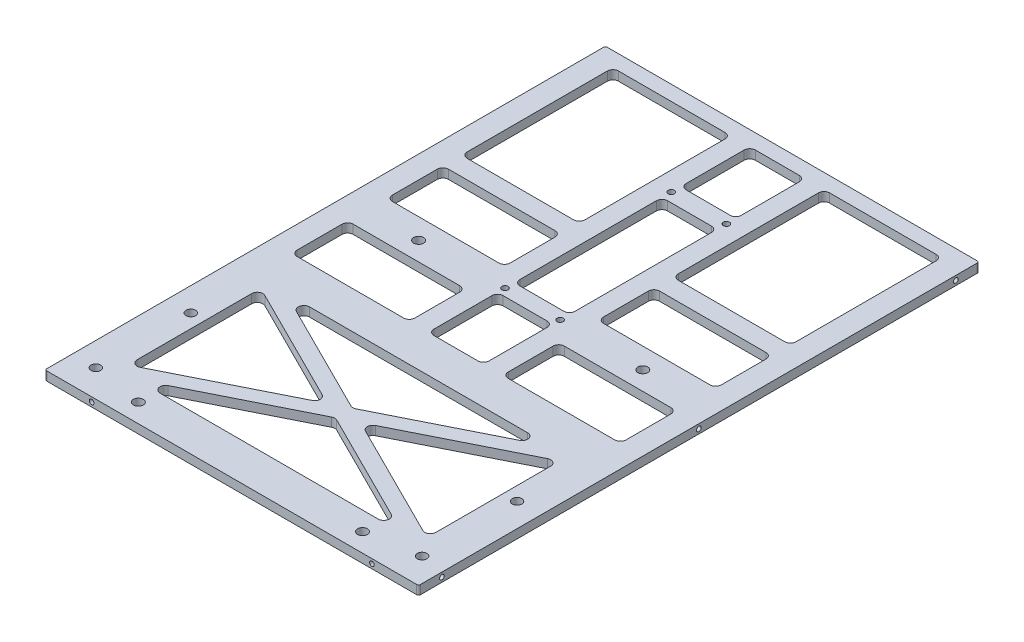
from build123d import *

# Parameters (mm, degrees)
SKETCH1_W                            = 200
SKETCH1_H                            = 300
BOSS_EXTRUDE1_DEPTH                  = 4.7625
F_1_4_20_TAPPED_HOLE1_D              = 5.1054
M4X0_7_TAPPED_HOLE1_D                = 3.3
M5_CLEARANCE_HOLE1_D                 = 5.3
SKETCH9_W                            = 63
SKETCH9_H                            = 81
SKETCH9_W_2                          = 29.5
SKETCH9_H_2                          = 79
SKETCH9_H_3                          = 37
SKETCH9_H_4                          = 30
CUT_EXTRUDE1_DEPTH                   = 181.340459704
TAP_DRILL_FOR_M3X0_5_TAP1_AT_2_COUNT = 2
TAP_DRILL_FOR_M3X0_5_TAP1_AT_2_PITCH = 150
TAP_DRILL_FOR_M3X0_5_TAP2_AT_2_COUNT = 2
TAP_DRILL_FOR_M3X0_5_TAP2_AT_2_PITCH = 275
TAP_DRILL_FOR_M3X0_5_TAP2_AT_3_COUNT = 2
TAP_DRILL_FOR_M3X0_5_TAP2_AT_3_PITCH = 137.5
FILLET1_R                            = 3
FILLET2_R                            = 1


with BuildPart() as part:
    # Sketch1 → Boss-Extrude1 (new body)
    with BuildSketch(Plane(origin=(0, 0, 0), x_dir=(1, 0, 0), z_dir=(0, 1, 0))):
        Rectangle(SKETCH1_W, SKETCH1_H)
    extrude(amount=BOSS_EXTRUDE1_DEPTH)

    # 1/4-20 Tapped Hole1 (through all)
    with Locations(Plane(origin=(0, 4.7625, 0), x_dir=(1, 0, 0), z_dir=(0, 1, 0))):
        with Locations((-87.3, -84.6), (-87.3, -135.4), (87.3, -135.4), (87.3, -84.6)):
            Hole(F_1_4_20_TAPPED_HOLE1_D / 2)

    # M4x0.7 Tapped Hole1 (through all)
    with Locations(Plane(origin=(0, 4.7625, 0), x_dir=(1, 0, 0), z_dir=(0, 1, 0))):
        with Locations((-14.75, 11), (14.75, 11), (14.75, 100), (-14.75, 100)):
            Hole(M4X0_7_TAPPED_HOLE1_D / 2)

    # M5 Clearance Hole1 (through all)
    with Locations(Plane(origin=(0, 4.7625, 0), x_dir=(1, 0, 0), z_dir=(0, 1, 0))):
        with Locations((-60, 10), (-60, -140), (60, -140), (60, 10)):
            Hole(M5_CLEARANCE_HOLE1_D / 2)

    # Sketch9 → Cut-Extrude1 (cut, through all)
    with BuildSketch(Plane(origin=(0, 4.7625, 0), x_dir=(1, 0, 0), z_dir=(0, 1, 0))):
        Polygon((-80, -54.472135955), (-80, -125.527864045), (-8.94427191, -90), align=None)
        Polygon((-71.05572809, -50), (71.05572809, -50), (0, -85.527864045), align=None)
        Polygon((80, -54.472135955), (8.94427191, -90), (80, -125.527864045), align=None)
        Polygon((-71.05572809, -130), (0, -94.472135955), (71.05572809, -130), align=None)
        with Locations((-56.5, 101.5)):
            Rectangle(SKETCH9_W, SKETCH9_H)
        with Locations((56.5, 101.5)):
            Rectangle(SKETCH9_W, SKETCH9_H)
        with Locations((0, 55.5)):
            Rectangle(SKETCH9_W_2, SKETCH9_H_2)
        with Locations((0, 123.5)):
            Rectangle(SKETCH9_W_2, SKETCH9_H_3)
        with Locations((0, -11.5)):
            Rectangle(SKETCH9_W_2, SKETCH9_H_3)
        with Locations((-56.5, 36)):
            Rectangle(SKETCH9_W, SKETCH9_H_4)
        with Locations((-56.5, -15)):
            Rectangle(SKETCH9_W, SKETCH9_H_4)
        with Locations((56.5, -15)):
            Rectangle(SKETCH9_W, SKETCH9_H_4)
        with Locations((56.5, 36)):
            Rectangle(SKETCH9_W, SKETCH9_H_4)
    extrude(amount=-CUT_EXTRUDE1_DEPTH, mode=Mode.SUBTRACT)

    # Sketch12 → Tap Drill for M3x0.5 Tap1 (revolve, cut)
    with BuildSketch(Plane(origin=(-75, 2.38125, 150), x_dir=(0, -1, 0), z_dir=(1, 0, 0))):
        Polygon((0, 0), (0, 5.511075774), (1.25, 4.76), (1.25, 0), align=None)
    tap_drill_for_m3x0_5_tap1 = revolve(axis=Axis((-75, 2.38125, 156.35), (0, 0, -1)), mode=Mode.SUBTRACT)

    # Tap Drill for M3x0.5 Tap1 at 2: Tap Drill for M3x0.5 Tap1 ×2
    with Locations(*[(i * TAP_DRILL_FOR_M3X0_5_TAP1_AT_2_PITCH, 0, 0) for i in range(1, TAP_DRILL_FOR_M3X0_5_TAP1_AT_2_COUNT)]):
        add(tap_drill_for_m3x0_5_tap1, mode=Mode.SUBTRACT)

    # Mirror1: Tap Drill for M3x0.5 Tap1 across plane
    add(tap_drill_for_m3x0_5_tap1.mirror(Plane.XY), mode=Mode.SUBTRACT)

    # Mirror1 copy 1 sketch → Mirror1 copy 1 (revolve, cut)
    with BuildSketch(Plane(origin=(75, 2.38125, -150), x_dir=(0, -1, 0), z_dir=(1, 0, 0))):
        Polygon((0, 0), (0, -5.511075774), (1.25, -4.76), (1.25, 0), align=None)
    revolve(axis=Axis((75, 2.38125, -156.35), (0, 0, -1)), mode=Mode.SUBTRACT)

    # Sketch15 → Tap Drill for M3x0.5 Tap2 (revolve, cut)
    with BuildSketch(Plane(origin=(-100, 2.38125, -137.5), x_dir=(0, 0, 1), z_dir=(0, 1, 0))):
        Polygon((0, 0), (0, 5.511075774), (1.25, 4.76), (1.25, 0), align=None)
    tap_drill_for_m3x0_5_tap2 = revolve(axis=Axis((-106.35, 2.38125, -137.5), (1, 0, 0)), mode=Mode.SUBTRACT)

    # Tap Drill for M3x0.5 Tap2 at 2: Tap Drill for M3x0.5 Tap2 ×2
    with Locations(*[(0, 0, i * TAP_DRILL_FOR_M3X0_5_TAP2_AT_2_PITCH) for i in range(1, TAP_DRILL_FOR_M3X0_5_TAP2_AT_2_COUNT)]):
        add(tap_drill_for_m3x0_5_tap2, mode=Mode.SUBTRACT)

    # Tap Drill for M3x0.5 Tap2 at 3: Tap Drill for M3x0.5 Tap2 ×2
    with Locations(*[(0, 0, i * TAP_DRILL_FOR_M3X0_5_TAP2_AT_3_PITCH) for i in range(1, TAP_DRILL_FOR_M3X0_5_TAP2_AT_3_COUNT)]):
        add(tap_drill_for_m3x0_5_tap2, mode=Mode.SUBTRACT)

    # Mirror2: Tap Drill for M3x0.5 Tap2 across plane
    add(tap_drill_for_m3x0_5_tap2.mirror(Plane(origin=(0, 0, 0), x_dir=(0, 0, 1), z_dir=(1, 0, 0))), mode=Mode.SUBTRACT)

    # Mirror2 copy 1 sketch → Mirror2 copy 1 (revolve, cut)
    with BuildSketch(Plane(origin=(100, 2.38125, 137.5), x_dir=(0, 0, 1), z_dir=(0, 1, 0))):
        Polygon((0, 0), (0, -5.511075774), (1.25, -4.76), (1.25, 0), align=None)
    revolve(axis=Axis((106.35, 2.38125, 137.5), (1, 0, 0)), mode=Mode.SUBTRACT)

    # Mirror2 copy 2 sketch → Mirror2 copy 2 (revolve, cut)
    with BuildSketch(Plane(origin=(100, 2.38125, 0), x_dir=(0, 0, 1), z_dir=(0, 1, 0))):
        Polygon((0, 0), (0, -5.511075774), (1.25, -4.76), (1.25, 0), align=None)
    revolve(axis=Axis((106.35, 2.38125, 0), (1, 0, 0)), mode=Mode.SUBTRACT)

    # Fillet1
    fillet1_edges = [part.edges().sort_by_distance(p)[0] for p in [
        (14.75, 2.38125, -95),
        (14.75, 2.38125, -16),
        (-14.75, 2.38125, -16),
        (-14.75, 2.38125, -95),
        (25, 2.38125, 30),
        (25, 2.38125, 0),
        (88, 2.38125, 0),
        (88, 2.38125, 30),
        (88, 2.38125, -142),
        (88, 2.38125, -61),
        (25, 2.38125, -61),
        (25, 2.38125, -142),
        (-88, 2.38125, 30),
        (-88, 2.38125, 0),
        (-25, 2.38125, 0),
        (-25, 2.38125, 30),
        (71.05572809, 2.38125, 130),
        (-71.05572809, 2.38125, 130),
        (0, 2.38125, 94.472135955),
        (80, 2.38125, 54.472135955),
        (80, 2.38125, 125.527864045),
        (8.94427191, 2.38125, 90),
        (-80, 2.38125, 54.472135955),
        (-8.94427191, 2.38125, 90),
        (-80, 2.38125, 125.527864045),
        (0, 2.38125, 85.527864045),
        (-71.05572809, 2.38125, 50),
        (71.05572809, 2.38125, 50),
        (25, 2.38125, -21),
        (25, 2.38125, -51),
        (88, 2.38125, -51),
        (88, 2.38125, -21),
        (-25, 2.38125, -51),
        (-25, 2.38125, -21),
        (-88, 2.38125, -21),
        (-88, 2.38125, -51),
        (14.75, 2.38125, -7),
        (14.75, 2.38125, 30),
        (-14.75, 2.38125, 30),
        (-14.75, 2.38125, -7),
        (14.75, 2.38125, -142),
        (14.75, 2.38125, -105),
        (-14.75, 2.38125, -105),
        (-14.75, 2.38125, -142),
        (-25, 2.38125, -142),
        (-25, 2.38125, -61),
        (-88, 2.38125, -61),
        (-88, 2.38125, -142),
    ]]
    fillet(fillet1_edges, radius=FILLET1_R)

    # Fillet2
    fillet2_edges = [part.edges().sort_by_distance(p)[0] for p in [
        (100, 2.38125, 150),
        (-100, 2.38125, 150),
        (-100, 2.38125, -150),
        (100, 2.38125, -150),
    ]]
    fillet(fillet2_edges, radius=FILLET2_R)


solid = part.part
